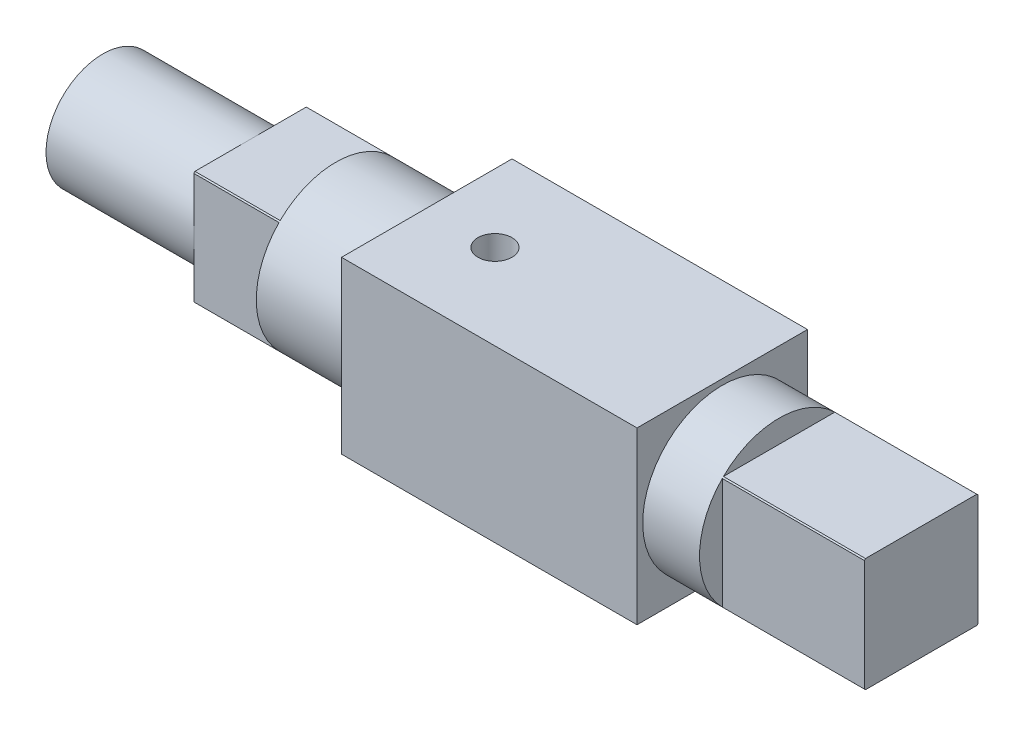
from build123d import *
from build123d.topology import SkipClean

# Parameters (mm, degrees)
SKETCH1_W           = 26
SKETCH1_H           = 15
BOSS_EXTRUDE1_DEPTH = 15
SKETCH2_R           = 1.5
CUT_EXTRUDE1_DEPTH  = 22.219095174
SKETCH3_R           = 7
BOSS_EXTRUDE2_DEPTH = 8
BOSS_EXTRUDE3_DEPTH = 7.5
SKETCH5_R           = 5
BOSS_EXTRUDE4_DEPTH = 13
BOSS_EXTRUDE5_START = 5
SKETCH6_R           = 7
BOSS_EXTRUDE5_DEPTH = 5
BOSS_EXTRUDE6_START = 12.5
BOSS_EXTRUDE6_DEPTH = 12.5
DOME1_FACE_RADIUS   = 5
DOME1_HEIGHT        = 1.3


with BuildPart() as part:
    # Sketch1 → Boss-Extrude1 (new body)
    with BuildSketch(Plane(origin=(0, 0, 0), x_dir=(1, 0, 0), z_dir=(0, 1, 0))):
        Rectangle(SKETCH1_W, SKETCH1_H)
    extrude(amount=BOSS_EXTRUDE1_DEPTH)

    # Sketch2 → Cut-Extrude1 (cut, through all)
    with BuildSketch(Plane(origin=(0, 15, 0), x_dir=(1, 0, 0), z_dir=(0, 1, 0))):
        with Locations(Location((-7, 0, 0), (0, 0, 270))):
            Circle(SKETCH2_R)
    extrude(amount=-CUT_EXTRUDE1_DEPTH, mode=Mode.SUBTRACT)

    # Sketch3 → Boss-Extrude2 (add)
    with BuildSketch(Plane.ZY.offset(13)):
        with Locations((0, 7.5)):
            Circle(SKETCH3_R)
    extrude(amount=BOSS_EXTRUDE2_DEPTH)

    # Sketch4 → Boss-Extrude3 (add)
    with BuildSketch(Plane.ZY.offset(21)):
        with BuildLine():
            Line((4.898979486, 12.5), (-4.898979486, 12.5))
            ThreePointArc((-4.898979486, 12.5), (-4.949747468, 12.449747468), (-5, 12.398979486))
            Line((-5, 12.398979486), (-5, 2.601020514))
            ThreePointArc((-5, 2.601020514), (-4.949747468, 2.550252532), (-4.898979486, 2.5))
            Line((-4.898979486, 2.5), (4.898979486, 2.5))
            ThreePointArc((4.898979486, 2.5), (4.949747468, 2.550252532), (5, 2.601020514))
            Line((5, 2.601020514), (5, 12.398979486))
            ThreePointArc((5, 12.398979486), (4.949747468, 12.449747468), (4.898979486, 12.5))
        make_face()
    extrude(amount=BOSS_EXTRUDE3_DEPTH)

    # Sketch5 → Boss-Extrude4 (add)
    with BuildSketch(Plane.ZY.offset(28.5)):
        with Locations((0, 7.5)):
            Circle(SKETCH5_R)
    extrude(amount=BOSS_EXTRUDE4_DEPTH)

    # Sketch6 → Boss-Extrude5 (add)
    with BuildSketch(Plane(origin=(13, 0, 0), x_dir=(0, 0, -1), z_dir=(1, 0, 0)).offset(BOSS_EXTRUDE5_START)):
        with Locations(Location((0, 7.5, 0), (0, 0, 315.584691403))):
            Circle(SKETCH6_R)
    extrude(amount=-BOSS_EXTRUDE5_DEPTH)

    # Sketch7 → Boss-Extrude6 (add)
    with SkipClean():  # the faces are left unmerged after this step: merging them gives an invalid solid
        with BuildSketch(Plane(origin=(18, 0, 0), x_dir=(0, 0, -1), z_dir=(1, 0, 0)).offset(BOSS_EXTRUDE6_START)):
            with BuildLine():
                ThreePointArc((-5, 2.601020514), (-4.949747468, 2.550252532), (-4.898979486, 2.5))
                Line((-4.898979486, 2.5), (4.898979486, 2.5))
                ThreePointArc((4.898979486, 2.5), (4.949747468, 2.550252532), (5, 2.601020514))
                Line((5, 2.601020514), (5, 12.398979486))
                ThreePointArc((5, 12.398979486), (4.949747468, 12.449747468), (4.898979486, 12.5))
                Line((4.898979486, 12.5), (-4.898979486, 12.5))
                ThreePointArc((-4.898979486, 12.5), (-4.949747468, 12.449747468), (-5, 12.398979486))
                Line((-5, 12.398979486), (-5, 2.601020514))
            make_face()
        extrude(amount=-BOSS_EXTRUDE6_DEPTH)

    # Dome1: a dome of height H over a round flat face of radius A is a cap of a sphere of radius (A * A + H * H) / (2 * H)
    dome1_r = (DOME1_FACE_RADIUS * DOME1_FACE_RADIUS + DOME1_HEIGHT * DOME1_HEIGHT) / (2 * DOME1_HEIGHT)
    dome1_base = Plane((-41.5, 7.5, 0), z_dir=(-1, 0, 0))
    with Locations(dome1_base.offset(DOME1_HEIGHT - dome1_r)):
        dome1_ball = Sphere(dome1_r, mode=Mode.PRIVATE)
    add(split(dome1_ball, bisect_by=dome1_base, keep=Keep.TOP, mode=Mode.PRIVATE))


solid = part.part
